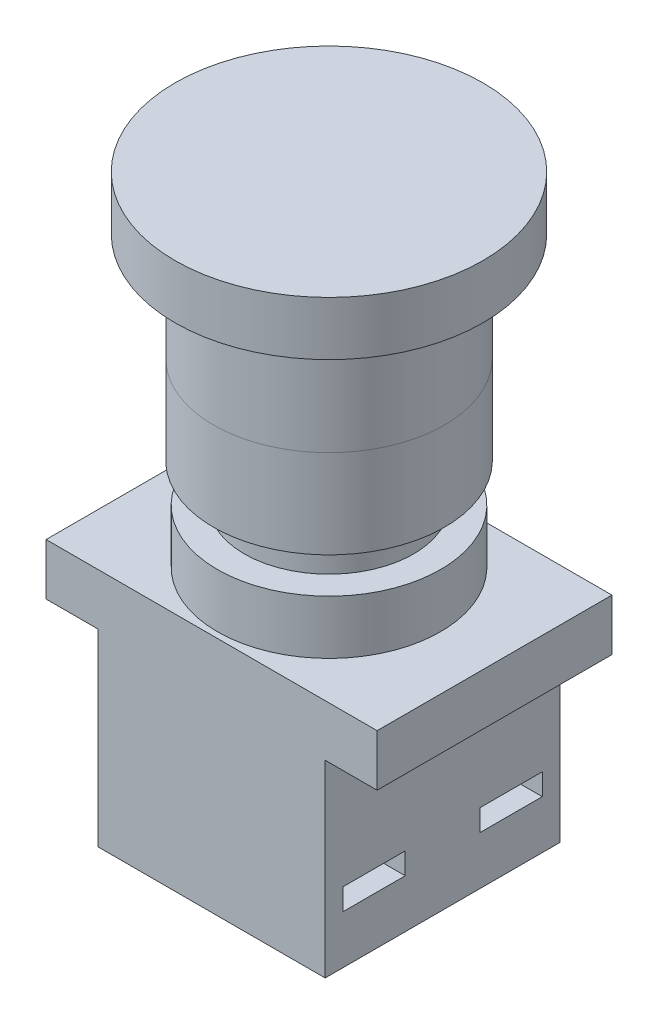
from build123d import *

# Parameters (mm, degrees)
ESQUISSE1_R             = 20
BOSS_EXTRU_1_DEPTH      = 7
ESQUISSE2_R             = 15
BOSS_EXTRU_2_DEPTH      = 14
ESQUISSE3_R             = 15
BOSS_EXTRU_3_DEPTH      = 11.5
ESQUISSE4_R             = 11
BOSS_EXTRU_4_DEPTH      = 12
ESQUISSE5_W             = 43
ESQUISSE5_H             = 30.5
BOSS_EXTRU_5_DEPTH      = 6.7
ESQUISSE6_W             = 29.5
ESQUISSE6_H             = 30.5
BOSS_EXTRU_6_DEPTH      = 24.5
ENL_V_START             = -6.3
ESQUISSE7_W             = 10
ESQUISSE7_H             = 8.1
ENL_V_MAT_EXTRU_1_DEPTH = 2.8
ESQUISSE8_R             = 14.5
BAGUE_SERRAGE_DEPTH     = 7


with BuildPart() as part:
    # Esquisse1 → Boss.-Extru.1 (new body)
    with BuildSketch(Plane(origin=(0, 0, 0), x_dir=(1, 0, 0), z_dir=(0, 1, 0))):
        with Locations(Location((0, 0, 0), (0, 0, 270))):
            Circle(ESQUISSE1_R)
    extrude(amount=-BOSS_EXTRU_1_DEPTH)

    # Esquisse2 → Boss.-Extru.2 (add)
    with BuildSketch(Plane.XZ.offset(7)):
        with Locations(Location((0, 0, 0), (0, 0, 270))):
            Circle(ESQUISSE2_R)
    extrude(amount=BOSS_EXTRU_2_DEPTH)


with BuildPart() as body_2:
    # Esquisse3 → Boss.-Extru.3 (new body)
    with BuildSketch(Plane.XZ.offset(21)):
        with Locations(Location((0, 0, 0), (0, 0, 270))):
            Circle(ESQUISSE3_R)
    extrude(amount=BOSS_EXTRU_3_DEPTH)

    # Esquisse4 → Boss.-Extru.4 (add)
    with BuildSketch(Plane.XZ.offset(32.5)):
        with Locations(Location((0, 0, 0), (0, 0, 270))):
            Circle(ESQUISSE4_R)
    extrude(amount=BOSS_EXTRU_4_DEPTH)

    # Esquisse5 → Boss.-Extru.5 (add)
    with BuildSketch(Plane.XZ.offset(44.5)):
        Rectangle(ESQUISSE5_W, ESQUISSE5_H)
    extrude(amount=BOSS_EXTRU_5_DEPTH)

    # Esquisse6 → Boss.-Extru.6 (add)
    with BuildSketch(Plane.XZ.offset(51.2)):
        Rectangle(ESQUISSE6_W, ESQUISSE6_H)
    extrude(amount=BOSS_EXTRU_6_DEPTH)

    # Esquisse7 → Enlèv. mat.-Extru.1 (cut)
    with BuildSketch(Plane.XZ.offset(75.7).offset(ENL_V_START)):
        with Locations((-9.75, 8.9)):
            Rectangle(ESQUISSE7_W, ESQUISSE7_H)
        with Locations((9.75, 8.9)):
            Rectangle(ESQUISSE7_W, ESQUISSE7_H)
        with Locations((9.75, -8.9)):
            Rectangle(ESQUISSE7_W, ESQUISSE7_H)
        with Locations((-9.75, -8.9)):
            Rectangle(ESQUISSE7_W, ESQUISSE7_H)
    extrude(amount=-ENL_V_MAT_EXTRU_1_DEPTH, mode=Mode.SUBTRACT)


with BuildPart() as body_3:
    # Esquisse8 → bague serrage (new body)
    with BuildSketch(Plane(origin=(0, -44.5, 0), x_dir=(1, 0, 0), z_dir=(0, 1, 0))):
        with Locations(Location((0, 0, 0), (0, 0, 270))):
            Circle(ESQUISSE8_R)
    extrude(amount=BAGUE_SERRAGE_DEPTH)


solid = Compound([part.part, body_2.part, body_3.part])
